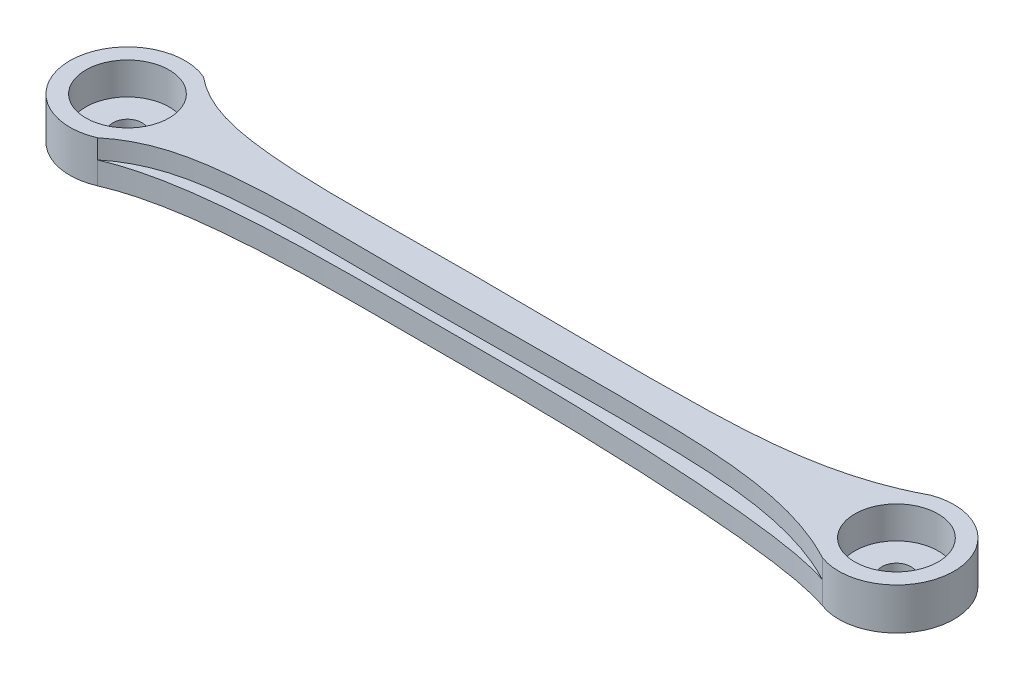
from build123d import *

# Parameters (mm, degrees)
SKETCH1_R           = 9
SKETCH1_R_2         = 2.25
BOSS_EXTRUDE1_DEPTH = 6.5
SKETCH2_R           = 6.5
CUT_EXTRUDE1_DEPTH  = 5
CUT_EXTRUDE2_DEPTH  = 3


with BuildPart() as part:
    # Sketch1 → Boss-Extrude1 (new body)
    # profile 1 of 3: a face of its own
    with BuildSketch(Plane(origin=(0, 0, 0), x_dir=(1, 0, 0), z_dir=(0, 1, 0))):
        with Locations((-120, 0)):
            Circle(SKETCH1_R)
        with Locations(Location((-120, 0, 0), (0, 0, 90))):
            Circle(SKETCH1_R_2, mode=Mode.SUBTRACT)
    # profile 2 of 3: a face of its own
    with BuildSketch(Plane(origin=(0, 0, 0), x_dir=(1, 0, 0), z_dir=(0, 1, 0))):
        with BuildLine():
            ThreePointArc((-116.409605108, 8.252821609), (-112.472930383, 4.933885182), (-111, 0))
            ThreePointArc((-111, 0), (-112.472930383, -4.933885182), (-116.409605108, -8.252821609))
            add(Edge.make_bspline(
                [(-116.409605108, -8.252821609), (-105.478903695, -3.497413535), (-80.532354503, -4.12846793), (-45.700894509, -3.892627812), (-12.04915124, -5.208001503), (-3.064915464, -8.462050177)],
                knots=[0, 0, 0, 0, 0.514412912, 0.614412912, 1, 1, 1, 1], degree=3))
            ThreePointArc((-3.064915464, -8.462050177), (-9, 0), (-3.064915464, 8.462050177))
            add(Edge.make_bspline(
                [(-116.409605108, 8.252821609), (-105.478903695, 3.497413535), (-80.532354503, 4.12846793), (-45.700894509, 3.892627812), (-12.04915124, 5.208001503), (-3.064915464, 8.462050177)],
                knots=[0, 0, 0, 0, 0.514412912, 0.614412912, 1, 1, 1, 1], degree=3))
        make_face()
    # profile 3 of 3: a face of its own
    with BuildSketch(Plane(origin=(0, 0, 0), x_dir=(1, 0, 0), z_dir=(0, 1, 0))):
        Circle(SKETCH1_R)
        with Locations(Location((0, 0, 0), (0, 0, 90))):
            Circle(SKETCH1_R_2, mode=Mode.SUBTRACT)
    extrude(amount=BOSS_EXTRUDE1_DEPTH)

    # Sketch2 → Cut-Extrude1 (cut)
    with BuildSketch(Plane(origin=(0, 6.5, 0), x_dir=(1, 0, 0), z_dir=(0, 1, 0))):
        with Locations(Location((-120, 0, 0), (0, 0, 270))):
            Circle(SKETCH2_R)
        with Locations(Location((0, 0, 0), (0, 0, 270))):
            Circle(SKETCH2_R)
    extrude(amount=-CUT_EXTRUDE1_DEPTH, mode=Mode.SUBTRACT)

    # Sketch3 → Cut-Extrude2 (cut)
    with BuildSketch(Plane(origin=(0, 6.5, 0), x_dir=(1, 0, 0), z_dir=(0, 1, 0))):
        with BuildLine():
            add(Edge.make_bspline(
                [(-116.409605108, -8.252821609), (-111.926525136, -4.515073542), (-103.615159098, -3.007845736), (-91.22070001, -2.347255299), (-77.849021373, -2.568456126), (-58.009603755, -2.53414615), (-32.098488239, -2.117697646), (-12.442081893, -3.452077228), (-3.064915464, -8.462050177)],
                knots=[0, 0, 0, 0, 0.145433364, 0.214931865, 0.323765467, 0.493222335, 0.731337307, 1, 1, 1, 1], degree=3))
            add(Edge.make_bspline(
                [(-116.409605108, -8.252821609), (-105.478903695, -3.497413535), (-80.532354503, -4.12846793), (-45.700894509, -3.892627812), (-12.04915124, -5.208001503), (-3.064915464, -8.462050177)],
                knots=[0, 0, 0, 0, 0.514412912, 0.614412912, 1, 1, 1, 1], degree=3))
        make_face()
        with BuildLine():
            add(Edge.make_bspline(
                [(-116.409605108, 8.252821609), (-111.926525136, 4.515073542), (-103.615159098, 3.007845736), (-91.22070001, 2.347255299), (-77.849021373, 2.568456126), (-58.009603755, 2.53414615), (-32.098488239, 2.117697646), (-12.442081893, 3.452077228), (-3.064915464, 8.462050177)],
                knots=[0, 0, 0, 0, 0.145433364, 0.214931865, 0.323765467, 0.493222335, 0.731337307, 1, 1, 1, 1], degree=3))
            add(Edge.make_bspline(
                [(-3.064915464, 8.462050177), (-12.04915124, 5.208001503), (-45.700894509, 3.892627812), (-80.532354503, 4.12846793), (-105.478903695, 3.497413535), (-116.409605108, 8.252821609)],
                knots=[0, 0, 0, 0, 0.385587088, 0.485587088, 1, 1, 1, 1], degree=3))
        make_face()
    extrude(amount=-CUT_EXTRUDE2_DEPTH, mode=Mode.SUBTRACT)


solid = part.part
